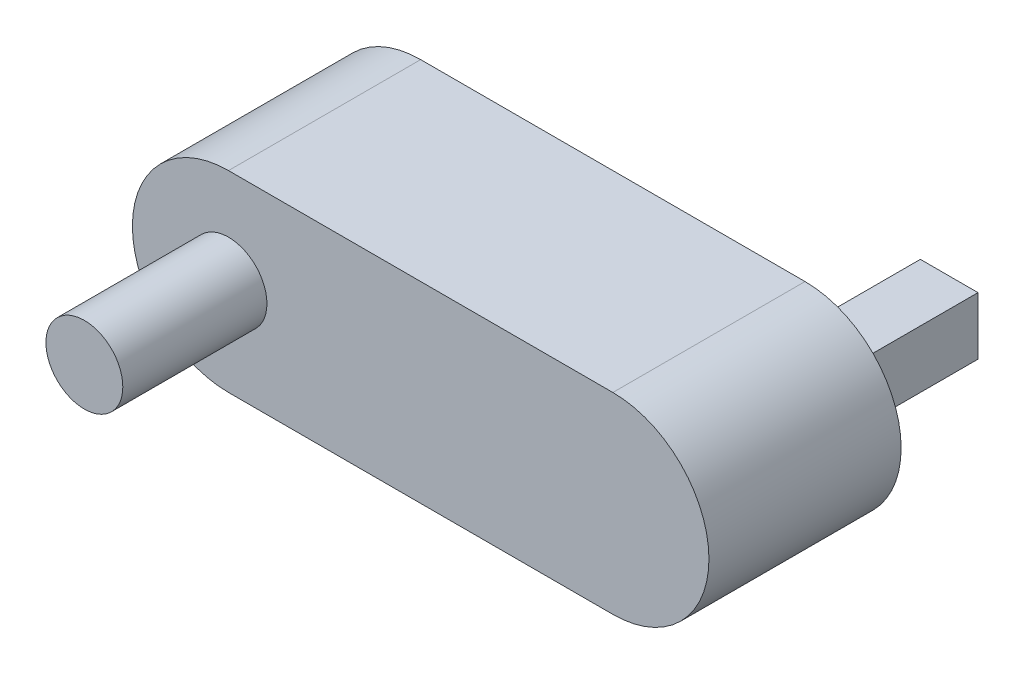
from build123d import *

# Parameters (mm, degrees)
EXTRUDE_1_DEPTH = 10
SKETCH_2_R      = 4
EXTRUDE_2_DEPTH = 15
SKETCH_3_W      = 6
SKETCH_3_H      = 6
EXTRUDE_3_DEPTH = 15


with BuildPart() as part:
    # 草图1 → 凸台-拉伸1 (new, symmetric)
    with BuildSketch(Plane.XY):
        with BuildLine():
            Line((0, 10), (40, 10))
            ThreePointArc((40, 10), (50, 0), (40, -10))
            Line((40, -10), (0, -10))
            ThreePointArc((0, -10), (-10, 0), (0, 10))
        make_face()
    extrude(amount=EXTRUDE_1_DEPTH, both=True)

    # 草图2 → 凸台-拉伸2 (add)
    with BuildSketch(Plane.XY.offset(10)):
        Circle(SKETCH_2_R)
    extrude(amount=EXTRUDE_2_DEPTH)

    # 草图3 → 凸台-拉伸3 (add)
    with BuildSketch(Plane(origin=(0, 0, -10), x_dir=(-1, 0, 0), z_dir=(0, 0, -1))):
        with Locations((-40, 0)):
            Rectangle(SKETCH_3_W, SKETCH_3_H)
    extrude(amount=EXTRUDE_3_DEPTH)


solid = part.part
